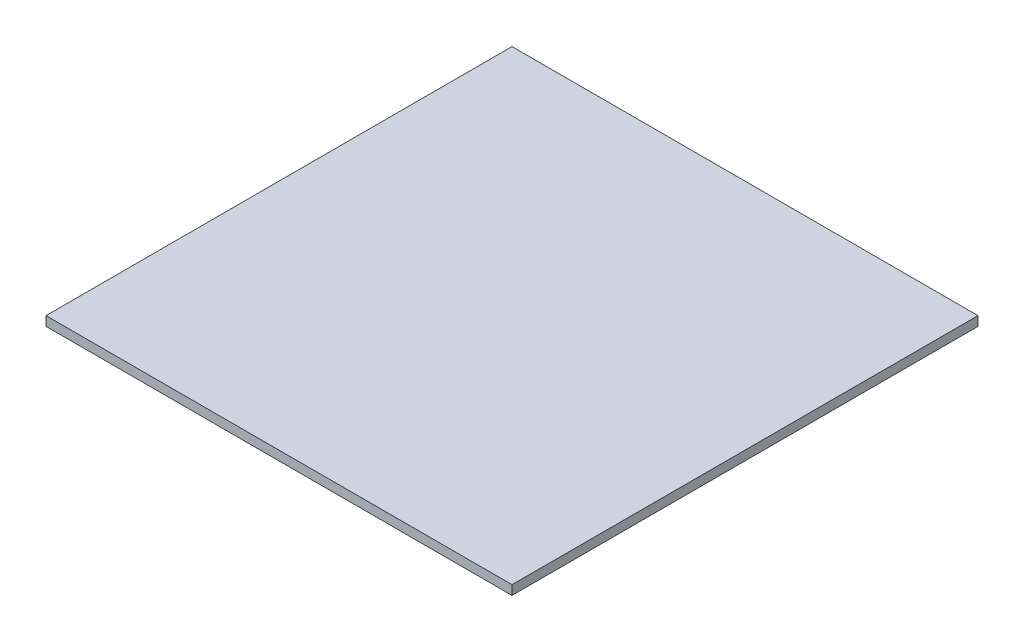
from build123d import *

# Parameters (mm, degrees)
ESBO_O1_W                = 250
ESBO_O1_H                = 250
RESSALTO_EXTRUS_O1_DEPTH = 5


with BuildPart() as part:
    # Esboço1 → Ressalto-extrusão1 (new body)
    with BuildSketch(Plane(origin=(0, 0, 0), x_dir=(1, 0, 0), z_dir=(0, 1, 0))):
        with Locations((125, 125)):
            Rectangle(ESBO_O1_W, ESBO_O1_H)
    extrude(amount=-RESSALTO_EXTRUS_O1_DEPTH)


solid = part.part
